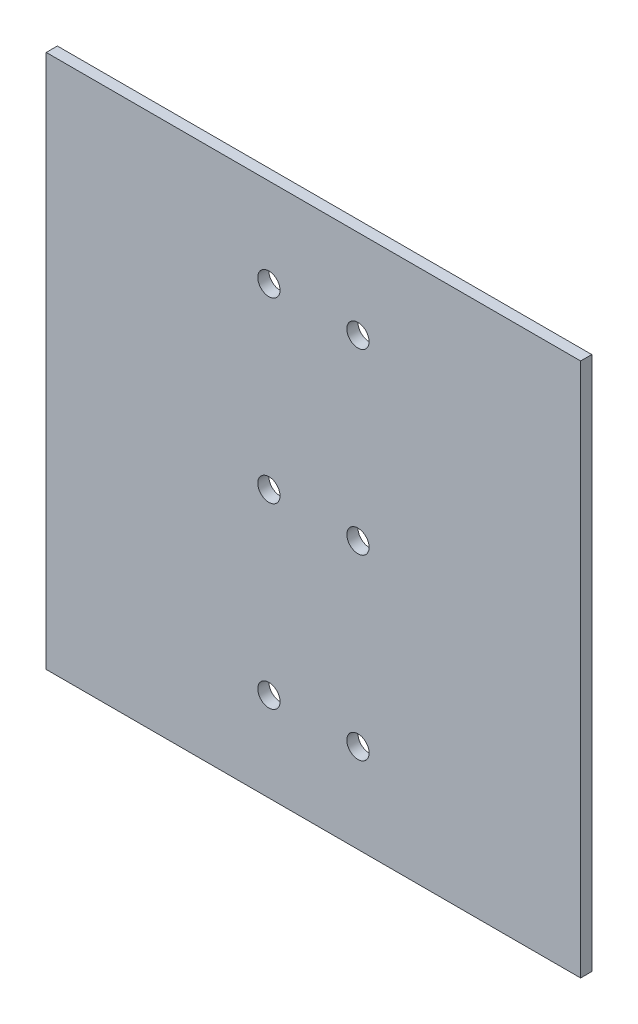
from build123d import *

# Parameters (mm, degrees)
SKETCH2_W           = 304.8
SKETCH2_H           = 304.8
SKETCH2_R           = 6.35
BOSS_EXTRUDE1_DEPTH = 6.35


with BuildPart() as part:
    # Sketch2 → Boss-Extrude1 (new body)
    with BuildSketch(Plane.XY):
        with Locations((152.4, 152.4)):
            Rectangle(SKETCH2_W, SKETCH2_H)
        with Locations((177.8, 50.8)):
            Circle(SKETCH2_R, mode=Mode.SUBTRACT)
        with Locations((127, 50.8)):
            Circle(SKETCH2_R, mode=Mode.SUBTRACT)
        with Locations((127, 152.4)):
            Circle(SKETCH2_R, mode=Mode.SUBTRACT)
        with Locations((127, 254)):
            Circle(SKETCH2_R, mode=Mode.SUBTRACT)
        with Locations((177.8, 152.4)):
            Circle(SKETCH2_R, mode=Mode.SUBTRACT)
        with Locations((177.8, 254)):
            Circle(SKETCH2_R, mode=Mode.SUBTRACT)
    extrude(amount=BOSS_EXTRUDE1_DEPTH)


solid = part.part
